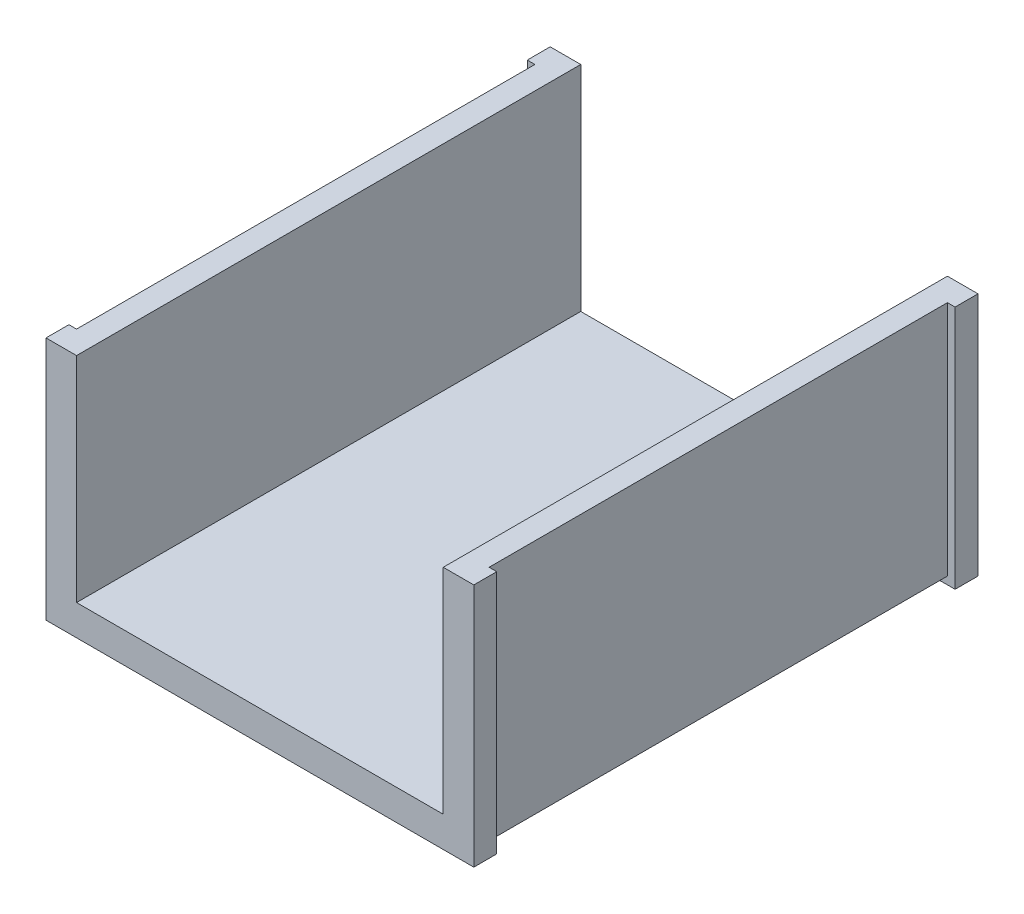
from build123d import *

# Parameters (mm, degrees)
BOSS_EXTRUDE1_DEPTH = 33
CUT_EXTRUDE1_START  = -1.5
CUT_EXTRUDE1_DEPTH  = 30


with BuildPart() as part:
    # Sketch1 → Boss-Extrude1 (new body)
    with BuildSketch(Plane.XY):
        Polygon((-37.75, -25.477481475), (-37.75, -9.477481475), (-39.75, -9.477481475), (-39.75, -23.477481475), (-63.75, -23.477481475), (-63.75, -9.477481475), (-65.75, -9.477481475), (-65.75, -25.477481475), align=None)
    extrude(amount=-BOSS_EXTRUDE1_DEPTH)

    # Sketch4 → Cut-Extrude1 (cut)
    with BuildSketch(Plane.XY.offset(CUT_EXTRUDE1_START)):
        Polygon((-65.25, -24.977481475), (-65.25, -9.477481475), (-65.75, -9.477481475), (-65.75, -25.477481475), (-37.75, -25.477481475), (-37.75, -9.477481475), (-38.25, -9.477481475), (-38.25, -24.977481475), align=None)
    extrude(amount=-CUT_EXTRUDE1_DEPTH, mode=Mode.SUBTRACT)


solid = part.part
